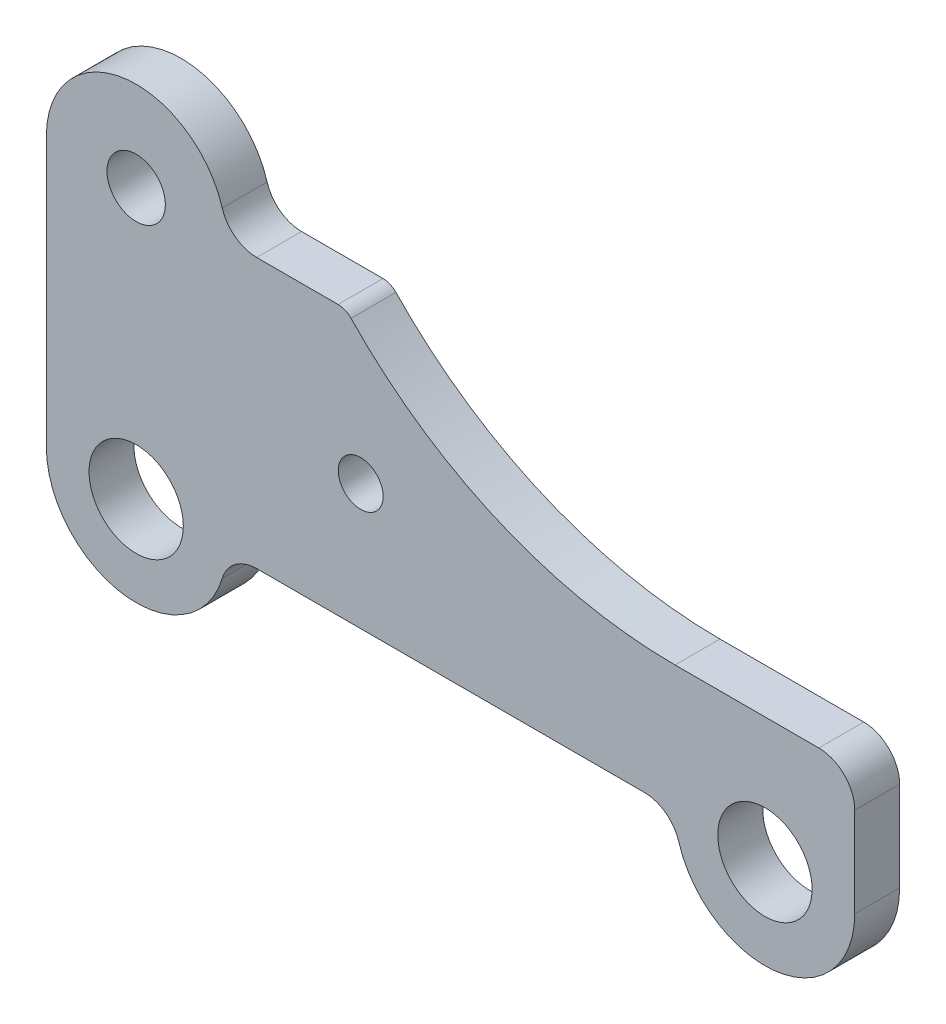
from build123d import *

# Parameters (mm, degrees)
SKETCH2_R           = 3.25
SKETCH2_R_2         = 5.25
SKETCH2_R_3         = 2.5
BOSS_EXTRUDE1_DEPTH = 2.5


with BuildPart() as part:
    # Sketch2 → Boss-Extrude1 (new, symmetric)
    with BuildSketch(Plane.XY):
        with BuildLine():
            Line((0, 40), (0, 10))
            ThreePointArc((0, 10), (8.556304179, 0.104761631), (19.583148475, 7.142857143))
            ThreePointArc((19.583148475, 7.142857143), (21.025950646, 9.207134903), (23.416407865, 10))
            Line((23.416407865, 10), (66.583592135, 10))
            ThreePointArc((66.583592135, 10), (68.974049354, 9.207134903), (70.416851525, 7.142857143))
            ThreePointArc((70.416851525, 7.142857143), (81.443695821, 0.104761631), (90, 10))
            Line((90, 10), (90, 20))
            ThreePointArc((90, 20), (88.828427125, 22.828427125), (86, 24))
            Line((86, 24), (70, 24))
            ThreePointArc((70, 24), (50.388386486, 28.00668945), (33.919878771, 39.384615385))
            ThreePointArc((33.919878771, 39.384615385), (33.261138462, 39.839732422), (32.476673921, 40))
            Line((32.476673921, 40), (23.416407865, 40))
            ThreePointArc((23.416407865, 40), (21.025950646, 40.792865097), (19.583148475, 42.857142857))
            ThreePointArc((19.583148475, 42.857142857), (8.556304179, 49.895238369), (0, 40))
        make_face()
        with Locations((10, 40)):
            Circle(SKETCH2_R, mode=Mode.SUBTRACT)
        with Locations((10, 10)):
            Circle(SKETCH2_R_2, mode=Mode.SUBTRACT)
        with Locations((80, 10)):
            Circle(SKETCH2_R_2, mode=Mode.SUBTRACT)
        with Locations((35, 24)):
            Circle(SKETCH2_R_3, mode=Mode.SUBTRACT)
    extrude(amount=BOSS_EXTRUDE1_DEPTH, both=True)


solid = part.part
